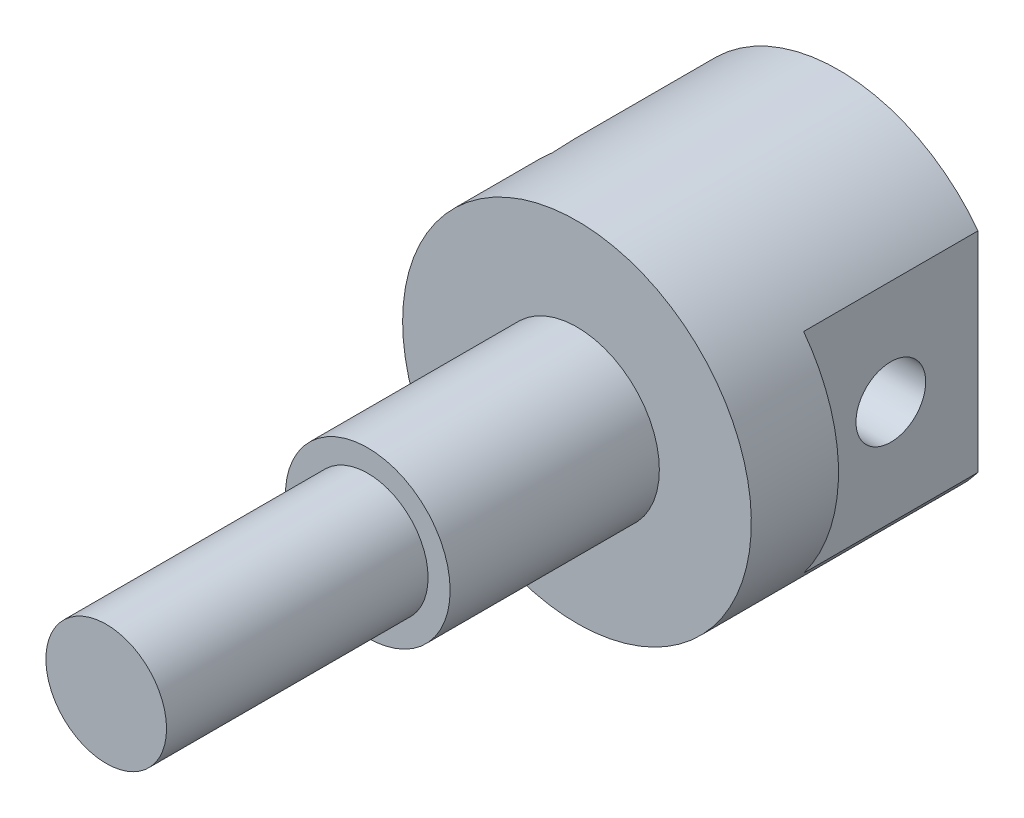
from build123d import *

# Parameters (mm, degrees)
SKETCH1_R               = 4.725
BOSS_EXTRUDE1_DEPTH     = 12
SKETCH2_R               = 3.46
BOSS_EXTRUDE2_DEPTH     = 15
SKETCH5_R               = 10
BOSS_EXTRUDE3_DEPTH     = 15
CUT_EXTRUDE1_DEPTH      = 5
CUT_EXTRUDE1_DEPTH_BACK = 15
SKETCH4_W               = 2
SKETCH4_H               = 12
CUT_EXTRUDE2_DEPTH      = 10
CUT_EXTRUDE3_REACH      = 35.956
SKETCH6_R               = 2


with BuildPart() as part:
    # Sketch1 → Boss-Extrude1 (new body)
    with BuildSketch(Plane.XY):
        Circle(SKETCH1_R)
    extrude(amount=-BOSS_EXTRUDE1_DEPTH)

    # Sketch2 → Boss-Extrude2 (add)
    with BuildSketch(Plane.XY):
        Circle(SKETCH2_R)
    extrude(amount=BOSS_EXTRUDE2_DEPTH)

    # Sketch5 → Boss-Extrude3 (add)
    with BuildSketch(Plane(origin=(0, 0, -12), x_dir=(-1, 0, 0), z_dir=(0, 0, -1))):
        Circle(SKETCH5_R)
    extrude(amount=BOSS_EXTRUDE3_DEPTH)

    # Sketch3 → Cut-Extrude1 (cut, two sides: drawn at the far end of the back side and taken through both)
    with BuildSketch(Plane(origin=(0, 0, 0), x_dir=(0, 0, -1), z_dir=(1, 0, 0)).offset(-CUT_EXTRUDE1_DEPTH_BACK)):
        Polygon((27, -5), (27, 5), (17, 7.679491924), (17, -7.679491924), align=None)
    extrude(amount=CUT_EXTRUDE1_DEPTH + CUT_EXTRUDE1_DEPTH_BACK, mode=Mode.SUBTRACT)

    # Sketch4 → Cut-Extrude2 (cut)
    with BuildSketch(Plane(origin=(0, 0, -27), x_dir=(-1, 0, 0), z_dir=(0, 0, -1))):
        with Locations((-9, 0)):
            Rectangle(SKETCH4_W, SKETCH4_H)
    extrude(amount=-CUT_EXTRUDE2_DEPTH, mode=Mode.SUBTRACT)

    # Sketch6 → Cut-Extrude3 (cut, up to next)
    with BuildSketch(Plane(origin=(8, 0, 0), x_dir=(0, 0, -1), z_dir=(1, 0, 0)), mode=Mode.PRIVATE) as cut_extrude3_sk1:
        with Locations((22, 0)):
            Circle(SKETCH6_R)
    cut_extrude3_tool1 = extrude(cut_extrude3_sk1.sketch, amount=-CUT_EXTRUDE3_REACH, mode=Mode.PRIVATE) & part.part
    add(cut_extrude3_tool1.solids().sort_by_distance((8, 0, -22))[0], mode=Mode.SUBTRACT)


solid = part.part
